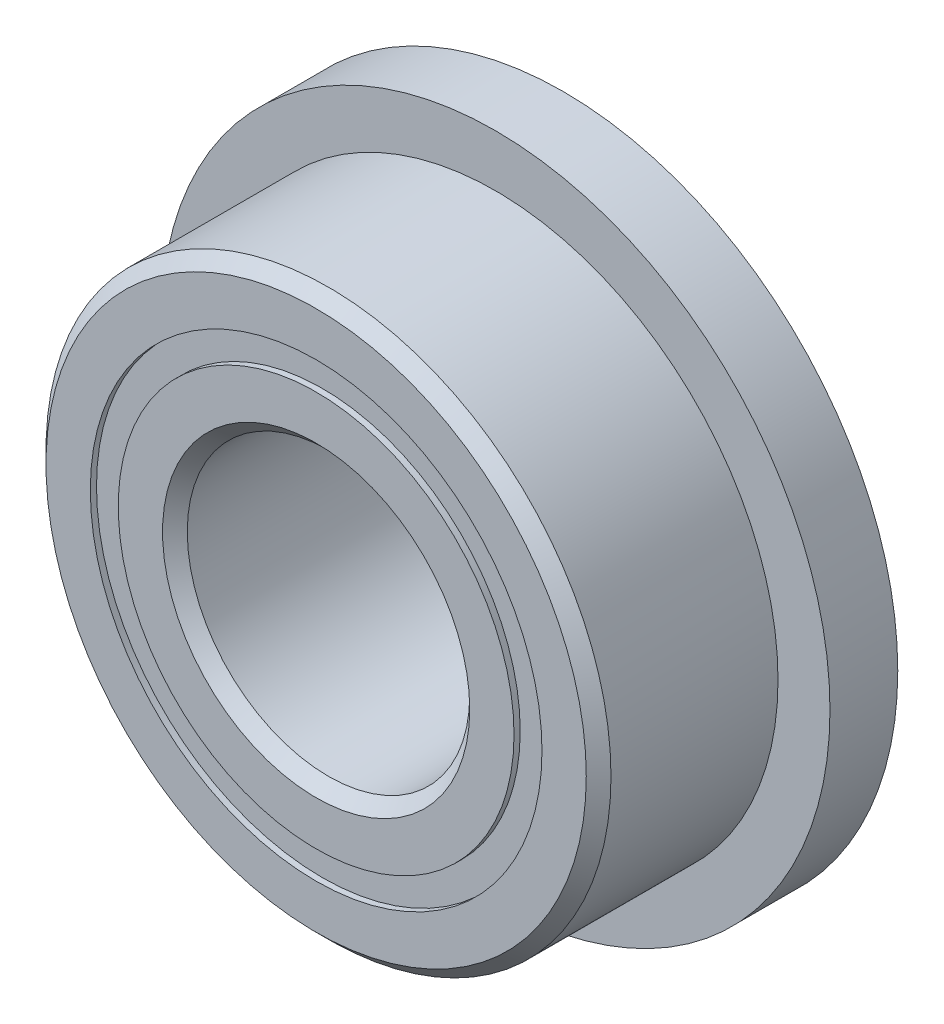
from build123d import *

# Parameters (mm, degrees)
CIRPATTERN1_COUNT = 10
SKETCH5_W         = 0.68259645
SKETCH5_H         = 0.31401099
SKETCH6_W         = 0.762
SKETCH6_H         = 1.220944505


with BuildPart() as part:
    # Sketch → Revolve1 (revolve)
    with BuildSketch(Plane(origin=(0, 0, 0), x_dir=(0, 0, -1), z_dir=(1, 0, 0))):
        with BuildLine():
            Line((1.25015625, 3.175), (-1.25015625, 3.175))
            Line((-1.25015625, 3.175), (-1.3890625, 3.03609375))
            Line((-1.3890625, 3.03609375), (-1.3890625, 2.538255495))
            Line((-1.3890625, 2.538255495), (-0.617361111, 2.538255495))
            ThreePointArc((-0.617361111, 2.538255495), (0, 3.018262925), (0.617361111, 2.538255495))
            Line((0.617361111, 2.538255495), (1.3890625, 2.538255495))
            Line((1.3890625, 2.538255495), (1.3890625, 3.03609375))
            Line((1.3890625, 3.03609375), (1.25015625, 3.175))
        make_face()
    revolve(axis=Axis((0, 0, 1.3890625), (0, 0, -1)))

    # Sketch6 → Revolve6 (revolve)
    with BuildSketch(Plane(origin=(0, 0, 0), x_dir=(0, 0, -1), z_dir=(1, 0, 0))):
        with Locations((1.0080625, 3.148727748)):
            Rectangle(SKETCH6_W, SKETCH6_H)
    revolve(axis=Axis((0, 0, -1.3890625), (0, 0, 1)))


with BuildPart() as body_2:
    # Sketch3 → Revolve3 (revolve)
    with BuildSketch(Plane(origin=(0, 0, 0), x_dir=(0, 0, -1), z_dir=(1, 0, 0))):
        with BuildLine():
            Line((-1.3890625, 2.224244505), (-0.617361111, 2.224244505))
            ThreePointArc((-0.617361111, 2.224244505), (0, 1.744237075), (0.617361111, 2.224244505))
            Line((0.617361111, 2.224244505), (1.3890625, 2.224244505))
            Line((1.3890625, 2.224244505), (1.3890625, 1.72640625))
            Line((1.3890625, 1.72640625), (1.25015625, 1.5875))
            Line((1.25015625, 1.5875), (-1.25015625, 1.5875))
            Line((-1.25015625, 1.5875), (-1.3890625, 1.72640625))
            Line((-1.3890625, 1.72640625), (-1.3890625, 2.224244505))
        make_face()
    revolve(axis=Axis((0, 0, 1.3890625), (0, 0, -1)))


with BuildPart() as body_3:
    # Sketch4 → Revolve4 (revolve)
    with BuildSketch(Plane(origin=(0, 0, 0), x_dir=(0, 0, -1), z_dir=(1, 0, 0))):
        with BuildLine():
            Line((-0.637012925, 2.38125), (0.637012925, 2.38125))
            ThreePointArc((0.637012925, 2.38125), (0, 3.018262925), (-0.637012925, 2.38125))
        make_face()
    revolve(axis=Axis((0, 2.38125, 0.637012925), (0, 0, -1)))


with BuildPart() as cirpattern1_1:
    # CirPattern1: pattern copy
    add(body_3.part.rotate(Axis((0, 0, -1.3890625), (0, 0, 1)), 1 * 360 / CIRPATTERN1_COUNT))


with BuildPart() as cirpattern1_2:
    # CirPattern1: pattern copy
    add(body_3.part.rotate(Axis((0, 0, -1.3890625), (0, 0, 1)), 2 * 360 / CIRPATTERN1_COUNT))


with BuildPart() as cirpattern1_3:
    # CirPattern1: pattern copy
    add(body_3.part.rotate(Axis((0, 0, -1.3890625), (0, 0, 1)), 3 * 360 / CIRPATTERN1_COUNT))


with BuildPart() as cirpattern1_4:
    # CirPattern1: pattern copy
    add(body_3.part.rotate(Axis((0, 0, -1.3890625), (0, 0, 1)), 4 * 360 / CIRPATTERN1_COUNT))


with BuildPart() as cirpattern1_5:
    # CirPattern1: pattern copy
    add(body_3.part.rotate(Axis((0, 0, -1.3890625), (0, 0, 1)), 5 * 360 / CIRPATTERN1_COUNT))


with BuildPart() as cirpattern1_6:
    # CirPattern1: pattern copy
    add(body_3.part.rotate(Axis((0, 0, -1.3890625), (0, 0, 1)), 6 * 360 / CIRPATTERN1_COUNT))


with BuildPart() as cirpattern1_7:
    # CirPattern1: pattern copy
    add(body_3.part.rotate(Axis((0, 0, -1.3890625), (0, 0, 1)), 7 * 360 / CIRPATTERN1_COUNT))


with BuildPart() as cirpattern1_8:
    # CirPattern1: pattern copy
    add(body_3.part.rotate(Axis((0, 0, -1.3890625), (0, 0, 1)), 8 * 360 / CIRPATTERN1_COUNT))


with BuildPart() as cirpattern1_9:
    # CirPattern1: pattern copy
    add(body_3.part.rotate(Axis((0, 0, -1.3890625), (0, 0, 1)), 9 * 360 / CIRPATTERN1_COUNT))


with BuildPart() as body_13:
    # Sketch5 → Revolve5 (revolve)
    with BuildSketch(Plane(origin=(0, 0, 0), x_dir=(0, 0, -1), z_dir=(1, 0, 0))):
        with Locations((-0.97831115, 2.38125)):
            Rectangle(SKETCH5_W, SKETCH5_H)
        with Locations((0.97831115, 2.38125)):
            Rectangle(SKETCH5_W, SKETCH5_H)
    revolve(axis=Axis((0, 0, 1.3890625), (0, 0, -1)))


solid = Compound([part.part, body_2.part, body_3.part, cirpattern1_1.part, cirpattern1_2.part, cirpattern1_3.part, cirpattern1_4.part, cirpattern1_5.part, cirpattern1_6.part, cirpattern1_7.part, cirpattern1_8.part, cirpattern1_9.part, body_13.part])
